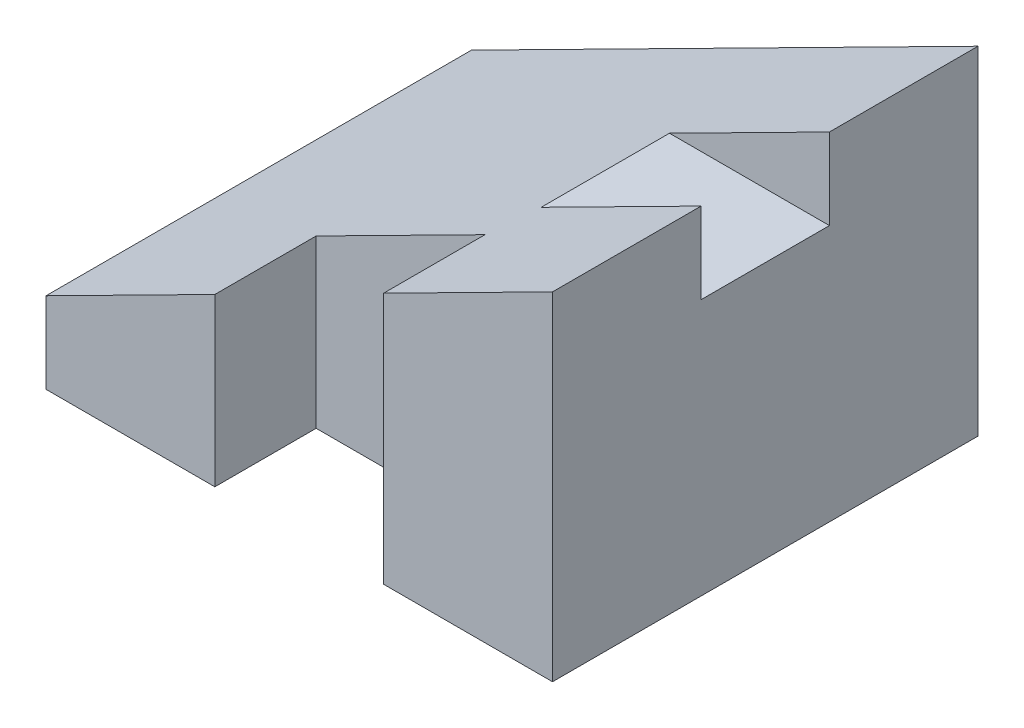
from build123d import *

# Parameters (mm, degrees)
BOSS_EXTRUDE1_DEPTH = 63
CUT_EXTRUDE1_DEPTH  = 15
SKETCH6_W           = 19
SKETCH6_H           = 12
CUT_EXTRUDE3_DEPTH  = 25


with BuildPart() as part:
    # Sketch1 → Boss-Extrude1 (new body)
    with BuildSketch(Plane.XY):
        Polygon((75, 0), (0, 0), (0, 12), (75, 50), align=None)
    extrude(amount=BOSS_EXTRUDE1_DEPTH)

    # Sketch2 → Cut-Extrude1 (cut)
    with BuildSketch(Plane.XY.offset(63)):
        Polygon((25, 24.666666667), (25, 0), (50, 0), (50, 37.333333333), align=None)
    extrude(amount=-CUT_EXTRUDE1_DEPTH, mode=Mode.SUBTRACT)

    # Sketch6 → Cut-Extrude3 (cut)
    with BuildSketch(Plane(origin=(75, 0, 0), x_dir=(0, 0, -1), z_dir=(1, 0, 0))):
        with Locations((-31.5, 44)):
            Rectangle(SKETCH6_W, SKETCH6_H)
    extrude(amount=-CUT_EXTRUDE3_DEPTH, mode=Mode.SUBTRACT)


solid = part.part
